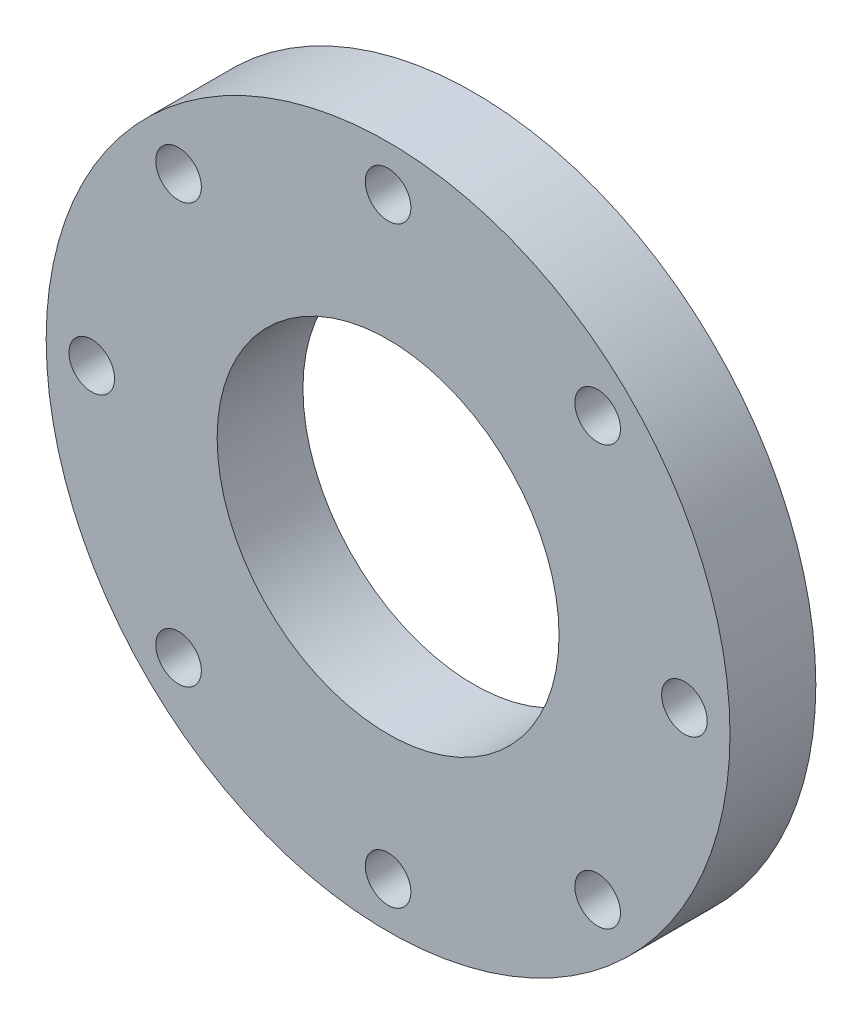
from build123d import *

# Parameters (mm, degrees)
SKETCH1_R             = 30
SKETCH1_R_2           = 15
BOSS_EXTRUDE1_DEPTH   = 7.53
F_1_0MM_DOWEL_HOLE1_D = 4
CIRPATTERN1_COUNT     = 8


with BuildPart() as part:
    # Sketch1 → Boss-Extrude1 (new body)
    with BuildSketch(Plane.XY):
        Circle(SKETCH1_R)
        Circle(SKETCH1_R_2, mode=Mode.SUBTRACT)
    extrude(amount=BOSS_EXTRUDE1_DEPTH)

    # Ø1.0mm Dowel Hole1 (through all)
    with Locations(Plane.XY.offset(7.53)):
        with Locations((0, 26)):
            f_1_0mm_dowel_hole1 = Hole(F_1_0MM_DOWEL_HOLE1_D / 2)

    # CirPattern1: Ø1.0mm Dowel Hole1 ×8 about axis
    cirpattern1_axis = Axis((0, 0, 0), (0, 0, 1))
    for i in range(1, CIRPATTERN1_COUNT):
        add(f_1_0mm_dowel_hole1.rotate(cirpattern1_axis, i * 360 / CIRPATTERN1_COUNT), mode=Mode.SUBTRACT)


solid = part.part
